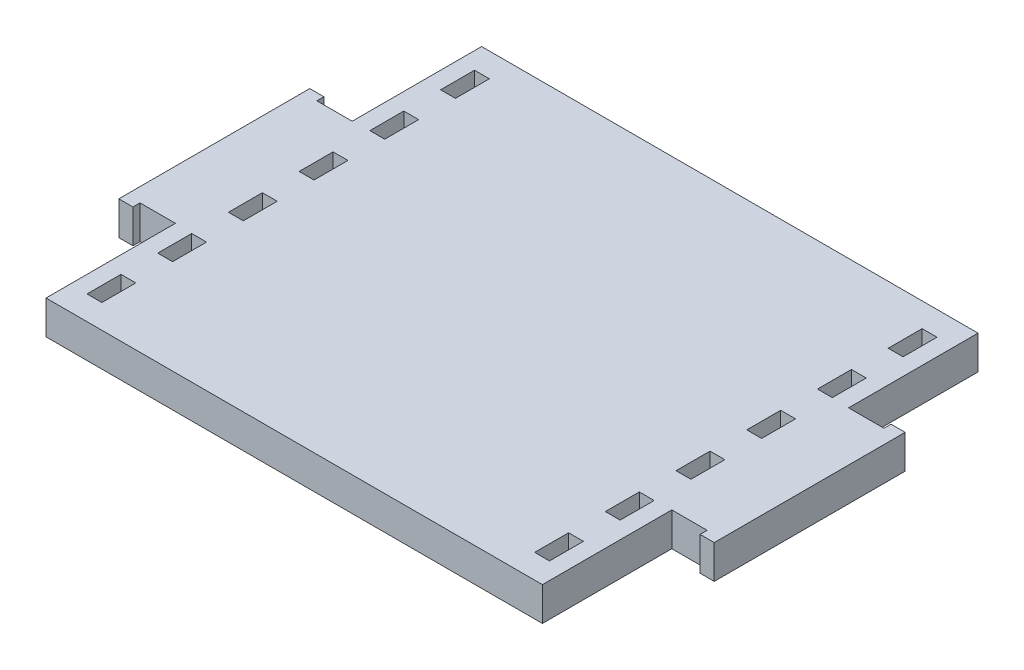
from build123d import *

# Parameters (mm, degrees)
SKETCH1_W           = 6.35
SKETCH1_H           = 31.75
BOSS_EXTRUDE1_DEPTH = 3.0226
SKETCH4_W           = 2.667
SKETCH4_H           = 6.096
CUT_EXTRUDE2_DEPTH  = 6.0452
SKETCH5_W           = 2.54
SKETCH5_H           = 34.29
BOSS_EXTRUDE2_DEPTH = 6.0452


with BuildPart() as part:
    # Sketch1 → Boss-Extrude1 (new, symmetric)
    with BuildSketch(Plane(origin=(0, 0, 0), x_dir=(1, 0, 0), z_dir=(0, 1, 0))):
        Polygon((0, -39.116), (0, 39.116), (-44.577, 39.116), (-44.577, 15.875), (-44.577, -15.875), (-44.577, -39.116), align=None)
        with Locations((-47.752, 0)):
            Rectangle(SKETCH1_W, SKETCH1_H)
        Polygon((44.577, 39.116), (0, 39.116), (0, -39.116), (44.577, -39.116), (44.577, -15.875), (44.577, 15.875), align=None)
        with Locations((47.752, 0)):
            Rectangle(SKETCH1_W, SKETCH1_H)
    extrude(amount=BOSS_EXTRUDE1_DEPTH, both=True)

    # Sketch4 → Cut-Extrude2 (cut)
    with BuildSketch(Plane(origin=(0, 3.0226, 0), x_dir=(1, 0, 0), z_dir=(0, 1, 0))):
        with Locations((-40.1955, -31.75)):
            Rectangle(SKETCH4_W, SKETCH4_H)
        with Locations((-40.1955, -19.05)):
            Rectangle(SKETCH4_W, SKETCH4_H)
        with Locations((-40.1955, -6.35)):
            Rectangle(SKETCH4_W, SKETCH4_H)
        with Locations((-40.1955, 6.35)):
            Rectangle(SKETCH4_W, SKETCH4_H)
        with Locations((-40.1955, 19.05)):
            Rectangle(SKETCH4_W, SKETCH4_H)
        with Locations((-40.1955, 31.75)):
            Rectangle(SKETCH4_W, SKETCH4_H)
        with Locations((40.1955, -19.05)):
            Rectangle(SKETCH4_W, SKETCH4_H)
        with Locations((40.1955, -6.35)):
            Rectangle(SKETCH4_W, SKETCH4_H)
        with Locations((40.1955, 6.35)):
            Rectangle(SKETCH4_W, SKETCH4_H)
        with Locations((40.1955, 19.05)):
            Rectangle(SKETCH4_W, SKETCH4_H)
        with Locations((40.1955, 31.75)):
            Rectangle(SKETCH4_W, SKETCH4_H)
        with Locations((40.1955, -31.75)):
            Rectangle(SKETCH4_W, SKETCH4_H)
    extrude(amount=-CUT_EXTRUDE2_DEPTH, mode=Mode.SUBTRACT)

    # Sketch5 → Boss-Extrude2 (add)
    with BuildSketch(Plane(origin=(0, 3.0226, 0), x_dir=(1, 0, 0), z_dir=(0, 1, 0))):
        with Locations((-52.197, 0)):
            Rectangle(SKETCH5_W, SKETCH5_H)
        with Locations((52.197, 0)):
            Rectangle(SKETCH5_W, SKETCH5_H)
    extrude(amount=-BOSS_EXTRUDE2_DEPTH)


solid = part.part
